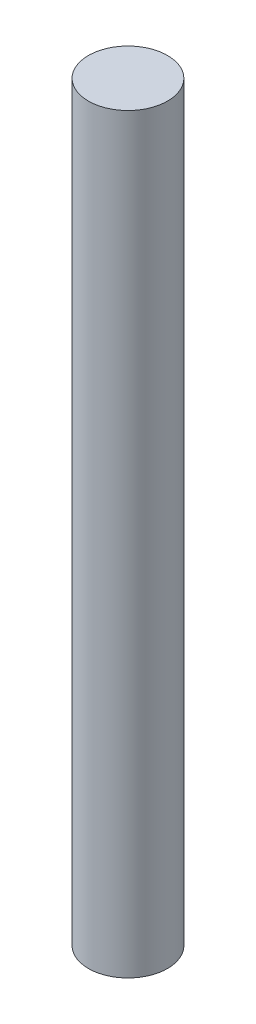
from build123d import *

# Parameters (mm, degrees)
SKETCH1_R           = 0.254
BOSS_EXTRUDE1_DEPTH = 4.826


with BuildPart() as part:
    # Sketch1 → Boss-Extrude1 (new body)
    with BuildSketch(Plane(origin=(0, 0, 0), x_dir=(1, 0, 0), z_dir=(0, 1, 0))):
        with Locations(Location((0, 0, 0), (0, 0, 270))):
            Circle(SKETCH1_R)
    extrude(amount=-BOSS_EXTRUDE1_DEPTH)


solid = part.part
